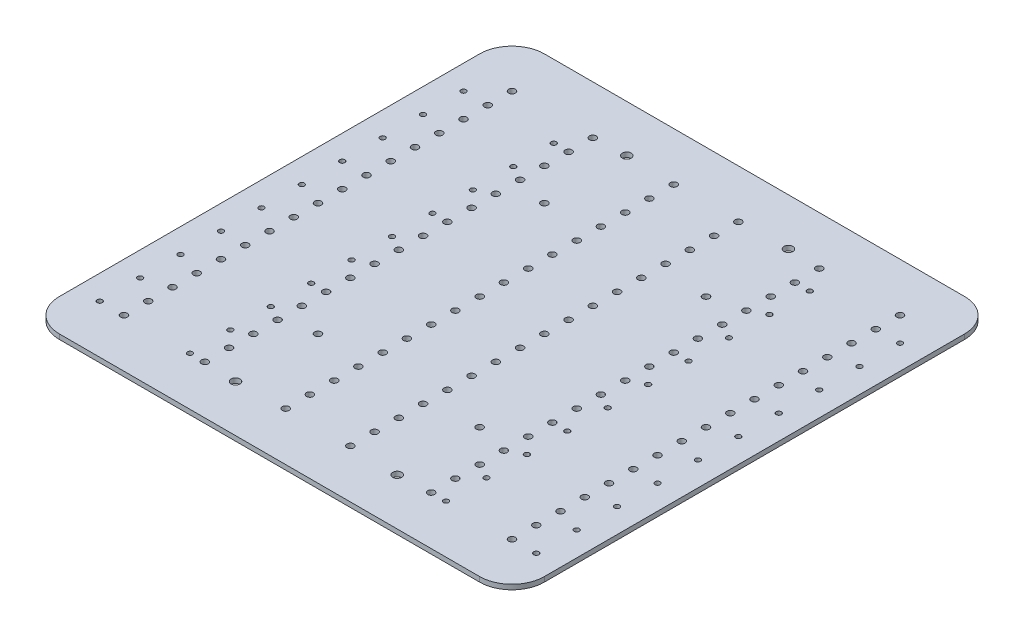
from build123d import *

# Parameters (mm, degrees)
SKETCH_2_W                        = 300
SKETCH_2_H                        = 300
EXTRUDE_1_DEPTH                   = 3
FILLET_1_R                        = 20
SKETCH_3_R                        = 2.1
CUT_EXTRUDE_1_DEPTH               = 213.153246499
MIRROR_2_COPY_1_SKETCH_R          = 2.1
MIRROR_2_COPY_1_DEPTH             = 213.153246499
SKETCH_4_R                        = 2.75
CUT_EXTRUDE_2_DEPTH               = 213.153246499
MIRROR_4_COPY_1_SKETCH_R          = 2.75
MIRROR_4_COPY_1_DEPTH             = 213.153246499
SKETCH_5_R                        = 2.1
CUT_EXTRUDE_3_DEPTH               = 213.153246499
PATTERN_LINEAR_1_COUNT            = 17
PATTERN_LINEAR_1_PITCH            = 15
PATTERN_LINEAR_2_COUNT            = 3
PATTERN_LINEAR_2_PITCH            = 50
PATTERN_LINEAR_2_COPY_1_SKETCH_R  = 2.1
PATTERN_LINEAR_2_COPY_1_DEPTH     = 213.153246499
PATTERN_LINEAR_2_COPY_2_SKETCH_R  = 2.1
PATTERN_LINEAR_2_COPY_2_DEPTH     = 213.153246499
PATTERN_LINEAR_2_COPY_3_SKETCH_R  = 2.1
PATTERN_LINEAR_2_COPY_3_DEPTH     = 213.153246499
PATTERN_LINEAR_2_COPY_4_SKETCH_R  = 2.1
PATTERN_LINEAR_2_COPY_4_DEPTH     = 213.153246499
PATTERN_LINEAR_2_COPY_5_SKETCH_R  = 2.1
PATTERN_LINEAR_2_COPY_5_DEPTH     = 213.153246499
PATTERN_LINEAR_2_COPY_6_SKETCH_R  = 2.1
PATTERN_LINEAR_2_COPY_6_DEPTH     = 213.153246499
PATTERN_LINEAR_2_COPY_7_SKETCH_R  = 2.1
PATTERN_LINEAR_2_COPY_7_DEPTH     = 213.153246499
PATTERN_LINEAR_2_COPY_8_SKETCH_R  = 2.1
PATTERN_LINEAR_2_COPY_8_DEPTH     = 213.153246499
PATTERN_LINEAR_2_COPY_9_SKETCH_R  = 2.1
PATTERN_LINEAR_2_COPY_9_DEPTH     = 213.153246499
PATTERN_LINEAR_2_COPY_10_SKETCH_R = 2.1
PATTERN_LINEAR_2_COPY_10_DEPTH    = 213.153246499
PATTERN_LINEAR_2_COPY_11_SKETCH_R = 2.1
PATTERN_LINEAR_2_COPY_11_DEPTH    = 213.153246499
PATTERN_LINEAR_2_COPY_12_SKETCH_R = 2.1
PATTERN_LINEAR_2_COPY_12_DEPTH    = 213.153246499
PATTERN_LINEAR_2_COPY_13_SKETCH_R = 2.1
PATTERN_LINEAR_2_COPY_13_DEPTH    = 213.153246499
PATTERN_LINEAR_2_COPY_14_SKETCH_R = 2.1
PATTERN_LINEAR_2_COPY_14_DEPTH    = 213.153246499
PATTERN_LINEAR_2_COPY_15_SKETCH_R = 2.1
PATTERN_LINEAR_2_COPY_15_DEPTH    = 213.153246499
PATTERN_LINEAR_2_COPY_16_SKETCH_R = 2.1
PATTERN_LINEAR_2_COPY_16_DEPTH    = 213.153246499
PATTERN_LINEAR_2_COPY_17_SKETCH_R = 2.1
PATTERN_LINEAR_2_COPY_17_DEPTH    = 213.153246499
PATTERN_LINEAR_2_COPY_18_SKETCH_R = 2.1
PATTERN_LINEAR_2_COPY_18_DEPTH    = 213.153246499
PATTERN_LINEAR_2_COPY_19_SKETCH_R = 2.1
PATTERN_LINEAR_2_COPY_19_DEPTH    = 213.153246499
PATTERN_LINEAR_2_COPY_20_SKETCH_R = 2.1
PATTERN_LINEAR_2_COPY_20_DEPTH    = 213.153246499
PATTERN_LINEAR_2_COPY_21_SKETCH_R = 2.1
PATTERN_LINEAR_2_COPY_21_DEPTH    = 213.153246499
PATTERN_LINEAR_2_COPY_22_SKETCH_R = 2.1
PATTERN_LINEAR_2_COPY_22_DEPTH    = 213.153246499
PATTERN_LINEAR_2_COPY_23_SKETCH_R = 2.1
PATTERN_LINEAR_2_COPY_23_DEPTH    = 213.153246499
PATTERN_LINEAR_2_COPY_24_SKETCH_R = 2.1
PATTERN_LINEAR_2_COPY_24_DEPTH    = 213.153246499
PATTERN_LINEAR_2_COPY_25_SKETCH_R = 2.1
PATTERN_LINEAR_2_COPY_25_DEPTH    = 213.153246499
PATTERN_LINEAR_2_COPY_26_SKETCH_R = 2.1
PATTERN_LINEAR_2_COPY_26_DEPTH    = 213.153246499
PATTERN_LINEAR_2_COPY_27_SKETCH_R = 2.1
PATTERN_LINEAR_2_COPY_27_DEPTH    = 213.153246499
PATTERN_LINEAR_2_COPY_28_SKETCH_R = 2.1
PATTERN_LINEAR_2_COPY_28_DEPTH    = 213.153246499
PATTERN_LINEAR_2_COPY_29_SKETCH_R = 2.1
PATTERN_LINEAR_2_COPY_29_DEPTH    = 213.153246499
PATTERN_LINEAR_2_COPY_30_SKETCH_R = 2.1
PATTERN_LINEAR_2_COPY_30_DEPTH    = 213.153246499
PATTERN_LINEAR_2_COPY_31_SKETCH_R = 2.1
PATTERN_LINEAR_2_COPY_31_DEPTH    = 213.153246499
PATTERN_LINEAR_2_COPY_32_SKETCH_R = 2.1
PATTERN_LINEAR_2_COPY_32_DEPTH    = 213.153246499
MIRROR_5_COPY_1_SKETCH_R          = 2.1
MIRROR_5_COPY_1_DEPTH             = 213.153246499
MIRROR_5_COPY_2_SKETCH_R          = 2.1
MIRROR_5_COPY_2_DEPTH             = 213.153246499
MIRROR_5_COPY_3_SKETCH_R          = 2.1
MIRROR_5_COPY_3_DEPTH             = 213.153246499
MIRROR_5_COPY_4_SKETCH_R          = 2.1
MIRROR_5_COPY_4_DEPTH             = 213.153246499
MIRROR_5_COPY_5_SKETCH_R          = 2.1
MIRROR_5_COPY_5_DEPTH             = 213.153246499
MIRROR_5_COPY_6_SKETCH_R          = 2.1
MIRROR_5_COPY_6_DEPTH             = 213.153246499
MIRROR_5_COPY_7_SKETCH_R          = 2.1
MIRROR_5_COPY_7_DEPTH             = 213.153246499
MIRROR_5_COPY_8_SKETCH_R          = 2.1
MIRROR_5_COPY_8_DEPTH             = 213.153246499
MIRROR_5_COPY_9_SKETCH_R          = 2.1
MIRROR_5_COPY_9_DEPTH             = 213.153246499
MIRROR_5_COPY_10_SKETCH_R         = 2.1
MIRROR_5_COPY_10_DEPTH            = 213.153246499
MIRROR_5_COPY_11_SKETCH_R         = 2.1
MIRROR_5_COPY_11_DEPTH            = 213.153246499
MIRROR_5_COPY_12_SKETCH_R         = 2.1
MIRROR_5_COPY_12_DEPTH            = 213.153246499
MIRROR_5_COPY_13_SKETCH_R         = 2.1
MIRROR_5_COPY_13_DEPTH            = 213.153246499
MIRROR_5_COPY_14_SKETCH_R         = 2.1
MIRROR_5_COPY_14_DEPTH            = 213.153246499
MIRROR_5_COPY_15_SKETCH_R         = 2.1
MIRROR_5_COPY_15_DEPTH            = 213.153246499
MIRROR_5_COPY_16_SKETCH_R         = 2.1
MIRROR_5_COPY_16_DEPTH            = 213.153246499
MIRROR_5_COPY_17_SKETCH_R         = 2.1
MIRROR_5_COPY_17_DEPTH            = 213.153246499
MIRROR_5_COPY_18_SKETCH_R         = 2.1
MIRROR_5_COPY_18_DEPTH            = 213.153246499
MIRROR_5_COPY_19_SKETCH_R         = 2.1
MIRROR_5_COPY_19_DEPTH            = 213.153246499
MIRROR_5_COPY_20_SKETCH_R         = 2.1
MIRROR_5_COPY_20_DEPTH            = 213.153246499
MIRROR_5_COPY_21_SKETCH_R         = 2.1
MIRROR_5_COPY_21_DEPTH            = 213.153246499
MIRROR_5_COPY_22_SKETCH_R         = 2.1
MIRROR_5_COPY_22_DEPTH            = 213.153246499
MIRROR_5_COPY_23_SKETCH_R         = 2.1
MIRROR_5_COPY_23_DEPTH            = 213.153246499
MIRROR_5_COPY_24_SKETCH_R         = 2.1
MIRROR_5_COPY_24_DEPTH            = 213.153246499
MIRROR_5_COPY_25_SKETCH_R         = 2.1
MIRROR_5_COPY_25_DEPTH            = 213.153246499
MIRROR_5_COPY_26_SKETCH_R         = 2.1
MIRROR_5_COPY_26_DEPTH            = 213.153246499
MIRROR_5_COPY_27_SKETCH_R         = 2.1
MIRROR_5_COPY_27_DEPTH            = 213.153246499
MIRROR_5_COPY_28_SKETCH_R         = 2.1
MIRROR_5_COPY_28_DEPTH            = 213.153246499
MIRROR_5_COPY_29_SKETCH_R         = 2.1
MIRROR_5_COPY_29_DEPTH            = 213.153246499
MIRROR_5_COPY_30_SKETCH_R         = 2.1
MIRROR_5_COPY_30_DEPTH            = 213.153246499
MIRROR_5_COPY_31_SKETCH_R         = 2.1
MIRROR_5_COPY_31_DEPTH            = 213.153246499
MIRROR_5_COPY_32_SKETCH_R         = 2.1
MIRROR_5_COPY_32_DEPTH            = 213.153246499
MIRROR_5_COPY_33_SKETCH_R         = 2.1
MIRROR_5_COPY_33_DEPTH            = 213.153246499
MIRROR_5_COPY_34_SKETCH_R         = 2.1
MIRROR_5_COPY_34_DEPTH            = 213.153246499
MIRROR_5_COPY_35_SKETCH_R         = 2.1
MIRROR_5_COPY_35_DEPTH            = 213.153246499
MIRROR_5_COPY_36_SKETCH_R         = 2.1
MIRROR_5_COPY_36_DEPTH            = 213.153246499
MIRROR_5_COPY_37_SKETCH_R         = 2.1
MIRROR_5_COPY_37_DEPTH            = 213.153246499
MIRROR_5_COPY_38_SKETCH_R         = 2.1
MIRROR_5_COPY_38_DEPTH            = 213.153246499
MIRROR_5_COPY_39_SKETCH_R         = 2.1
MIRROR_5_COPY_39_DEPTH            = 213.153246499
MIRROR_5_COPY_40_SKETCH_R         = 2.1
MIRROR_5_COPY_40_DEPTH            = 213.153246499
MIRROR_5_COPY_41_SKETCH_R         = 2.1
MIRROR_5_COPY_41_DEPTH            = 213.153246499
MIRROR_5_COPY_42_SKETCH_R         = 2.1
MIRROR_5_COPY_42_DEPTH            = 213.153246499
MIRROR_5_COPY_43_SKETCH_R         = 2.1
MIRROR_5_COPY_43_DEPTH            = 213.153246499
MIRROR_5_COPY_44_SKETCH_R         = 2.1
MIRROR_5_COPY_44_DEPTH            = 213.153246499
MIRROR_5_COPY_45_SKETCH_R         = 2.1
MIRROR_5_COPY_45_DEPTH            = 213.153246499
MIRROR_5_COPY_46_SKETCH_R         = 2.1
MIRROR_5_COPY_46_DEPTH            = 213.153246499
MIRROR_5_COPY_47_SKETCH_R         = 2.1
MIRROR_5_COPY_47_DEPTH            = 213.153246499
MIRROR_5_COPY_48_SKETCH_R         = 2.1
MIRROR_5_COPY_48_DEPTH            = 213.153246499
MIRROR_5_COPY_49_SKETCH_R         = 2.1
MIRROR_5_COPY_49_DEPTH            = 213.153246499
MIRROR_5_COPY_50_SKETCH_R         = 2.1
MIRROR_5_COPY_50_DEPTH            = 213.153246499
SKETCH_6_R                        = 1.6
CUT_EXTRUDE_4_DEPTH               = 213.153246499
PATTERN_LINEAR_3_COUNT            = 10
PATTERN_LINEAR_3_PITCH            = 25
PATTERN_LINEAR_4_COUNT            = 2
PATTERN_LINEAR_4_PITCH            = 55.8
PATTERN_LINEAR_4_COPY_1_SKETCH_R  = 1.6
PATTERN_LINEAR_4_COPY_1_DEPTH     = 213.153246499
PATTERN_LINEAR_4_COPY_2_SKETCH_R  = 1.6
PATTERN_LINEAR_4_COPY_2_DEPTH     = 213.153246499
PATTERN_LINEAR_4_COPY_3_SKETCH_R  = 1.6
PATTERN_LINEAR_4_COPY_3_DEPTH     = 213.153246499
PATTERN_LINEAR_4_COPY_4_SKETCH_R  = 1.6
PATTERN_LINEAR_4_COPY_4_DEPTH     = 213.153246499
PATTERN_LINEAR_4_COPY_5_SKETCH_R  = 1.6
PATTERN_LINEAR_4_COPY_5_DEPTH     = 213.153246499
PATTERN_LINEAR_4_COPY_6_SKETCH_R  = 1.6
PATTERN_LINEAR_4_COPY_6_DEPTH     = 213.153246499
PATTERN_LINEAR_4_COPY_7_SKETCH_R  = 1.6
PATTERN_LINEAR_4_COPY_7_DEPTH     = 213.153246499
PATTERN_LINEAR_4_COPY_8_SKETCH_R  = 1.6
PATTERN_LINEAR_4_COPY_8_DEPTH     = 213.153246499
PATTERN_LINEAR_4_COPY_9_SKETCH_R  = 1.6
PATTERN_LINEAR_4_COPY_9_DEPTH     = 213.153246499
MIRROR_6_COPY_1_SKETCH_R          = 1.6
MIRROR_6_COPY_1_DEPTH             = 213.153246499
MIRROR_6_COPY_2_SKETCH_R          = 1.6
MIRROR_6_COPY_2_DEPTH             = 213.153246499
MIRROR_6_COPY_3_SKETCH_R          = 1.6
MIRROR_6_COPY_3_DEPTH             = 213.153246499
MIRROR_6_COPY_4_SKETCH_R          = 1.6
MIRROR_6_COPY_4_DEPTH             = 213.153246499
MIRROR_6_COPY_5_SKETCH_R          = 1.6
MIRROR_6_COPY_5_DEPTH             = 213.153246499
MIRROR_6_COPY_6_SKETCH_R          = 1.6
MIRROR_6_COPY_6_DEPTH             = 213.153246499
MIRROR_6_COPY_7_SKETCH_R          = 1.6
MIRROR_6_COPY_7_DEPTH             = 213.153246499
MIRROR_6_COPY_8_SKETCH_R          = 1.6
MIRROR_6_COPY_8_DEPTH             = 213.153246499
MIRROR_6_COPY_9_SKETCH_R          = 1.6
MIRROR_6_COPY_9_DEPTH             = 213.153246499
MIRROR_6_COPY_10_SKETCH_R         = 1.6
MIRROR_6_COPY_10_DEPTH            = 213.153246499
MIRROR_6_COPY_11_SKETCH_R         = 1.6
MIRROR_6_COPY_11_DEPTH            = 213.153246499
MIRROR_6_COPY_12_SKETCH_R         = 1.6
MIRROR_6_COPY_12_DEPTH            = 213.153246499
MIRROR_6_COPY_13_SKETCH_R         = 1.6
MIRROR_6_COPY_13_DEPTH            = 213.153246499
MIRROR_6_COPY_14_SKETCH_R         = 1.6
MIRROR_6_COPY_14_DEPTH            = 213.153246499
MIRROR_6_COPY_15_SKETCH_R         = 1.6
MIRROR_6_COPY_15_DEPTH            = 213.153246499
MIRROR_6_COPY_16_SKETCH_R         = 1.6
MIRROR_6_COPY_16_DEPTH            = 213.153246499
MIRROR_6_COPY_17_SKETCH_R         = 1.6
MIRROR_6_COPY_17_DEPTH            = 213.153246499
MIRROR_6_COPY_18_SKETCH_R         = 1.6
MIRROR_6_COPY_18_DEPTH            = 213.153246499
MIRROR_6_COPY_19_SKETCH_R         = 1.6
MIRROR_6_COPY_19_DEPTH            = 213.153246499


with BuildPart() as part:
    # 草图2 → 凸台-拉伸1 (new body)
    with BuildSketch(Plane(origin=(0, 0, 0), x_dir=(1, 0, 0), z_dir=(0, 1, 0))):
        Rectangle(SKETCH_2_W, SKETCH_2_H)
    extrude(amount=EXTRUDE_1_DEPTH)

    # 圆角1
    fillet_1_edges = [part.edges().sort_by_distance(p)[0] for p in [
        (150, 1.5, 150),
        (-150, 1.5, 150),
        (-150, 1.5, -150),
        (150, 1.5, -150),
    ]]
    fillet(fillet_1_edges, radius=FILLET_1_R)

    # 草图3 → 切除-拉伸1 (cut, through all)
    with BuildSketch(Plane.XZ):
        with Locations(Location((-50, 70, 0), (0, 0, 270))):
            Circle(SKETCH_3_R)
    cut_extrude_1 = extrude(amount=-CUT_EXTRUDE_1_DEPTH, mode=Mode.SUBTRACT)

    # 镜向1: 切除-拉伸1 across plane
    add(cut_extrude_1.mirror(Plane.ZY), mode=Mode.SUBTRACT)

    # 镜向2: 切除-拉伸1 across plane
    add(cut_extrude_1.mirror(Plane(origin=(0, 0, 0), x_dir=(1, 0, 0), z_dir=(0, 0, -1))), mode=Mode.SUBTRACT)

    # 镜向2 copy 1 sketch → 镜向2 copy 1 (cut, through all)
    with BuildSketch(Plane(origin=(0, 0, 0), x_dir=(-1, 0, 0), z_dir=(0, -1, 0))):
        with Locations(Location((-50, 70, 0), (0, 0, 270))):
            Circle(MIRROR_2_COPY_1_SKETCH_R)
    extrude(amount=-MIRROR_2_COPY_1_DEPTH, mode=Mode.SUBTRACT)

    # 草图4 → 切除-拉伸2 (cut, through all)
    with BuildSketch(Plane(origin=(0, 3, 0), x_dir=(1, 0, 0), z_dir=(0, 1, 0))):
        with Locations(Location((-50, -121, 0), (0, 0, 270))):
            Circle(SKETCH_4_R)
    cut_extrude_2 = extrude(amount=-CUT_EXTRUDE_2_DEPTH, mode=Mode.SUBTRACT)

    # 镜向3: 切除-拉伸2 across plane
    add(cut_extrude_2.mirror(Plane.ZY), mode=Mode.SUBTRACT)

    # 镜向4: 切除-拉伸2 across plane
    add(cut_extrude_2.mirror(Plane(origin=(0, 0, 0), x_dir=(1, 0, 0), z_dir=(0, 0, -1))), mode=Mode.SUBTRACT)

    # 镜向4 copy 1 sketch → 镜向4 copy 1 (cut, through all)
    with BuildSketch(Plane(origin=(0, 3, 0), x_dir=(-1, 0, 0), z_dir=(0, 1, 0))):
        with Locations(Location((-50, -121, 0), (0, 0, 270))):
            Circle(MIRROR_4_COPY_1_SKETCH_R)
    extrude(amount=-MIRROR_4_COPY_1_DEPTH, mode=Mode.SUBTRACT)

    # 草图5 → 切除-拉伸3 (cut, through all)
    with BuildSketch(Plane(origin=(0, 3, 0), x_dir=(1, 0, 0), z_dir=(0, 1, 0))):
        with Locations(Location((-120, -120, 0), (0, 0, 270))):
            Circle(SKETCH_5_R)
    cut_extrude_3 = extrude(amount=-CUT_EXTRUDE_3_DEPTH, mode=Mode.SUBTRACT)

    # 阵列(线性)1: 切除-拉伸3 ×17
    with Locations(*[(0, 0, -i * PATTERN_LINEAR_1_PITCH) for i in range(1, PATTERN_LINEAR_1_COUNT)]):
        add(cut_extrude_3, mode=Mode.SUBTRACT)

    # 阵列(线性)2: 切除-拉伸3 ×3
    with Locations(*[(i * PATTERN_LINEAR_2_PITCH, 0, 0) for i in range(1, PATTERN_LINEAR_2_COUNT)]):
        add(cut_extrude_3, mode=Mode.SUBTRACT)

    # 阵列(线性)2 copy 1 sketch → 阵列(线性)2 copy 1 (cut, through all)
    with BuildSketch(Plane(origin=(50, 3, -15), x_dir=(1, 0, 0), z_dir=(0, 1, 0))):
        with Locations(Location((-120, -120, 0), (0, 0, 270))):
            Circle(PATTERN_LINEAR_2_COPY_1_SKETCH_R)
    extrude(amount=-PATTERN_LINEAR_2_COPY_1_DEPTH, mode=Mode.SUBTRACT)

    # 阵列(线性)2 copy 2 sketch → 阵列(线性)2 copy 2 (cut, through all)
    with BuildSketch(Plane(origin=(100, 3, -15), x_dir=(1, 0, 0), z_dir=(0, 1, 0))):
        with Locations(Location((-120, -120, 0), (0, 0, 270))):
            Circle(PATTERN_LINEAR_2_COPY_2_SKETCH_R)
    extrude(amount=-PATTERN_LINEAR_2_COPY_2_DEPTH, mode=Mode.SUBTRACT)

    # 阵列(线性)2 copy 3 sketch → 阵列(线性)2 copy 3 (cut, through all)
    with BuildSketch(Plane(origin=(50, 3, -30), x_dir=(1, 0, 0), z_dir=(0, 1, 0))):
        with Locations(Location((-120, -120, 0), (0, 0, 270))):
            Circle(PATTERN_LINEAR_2_COPY_3_SKETCH_R)
    extrude(amount=-PATTERN_LINEAR_2_COPY_3_DEPTH, mode=Mode.SUBTRACT)

    # 阵列(线性)2 copy 4 sketch → 阵列(线性)2 copy 4 (cut, through all)
    with BuildSketch(Plane(origin=(100, 3, -30), x_dir=(1, 0, 0), z_dir=(0, 1, 0))):
        with Locations(Location((-120, -120, 0), (0, 0, 270))):
            Circle(PATTERN_LINEAR_2_COPY_4_SKETCH_R)
    extrude(amount=-PATTERN_LINEAR_2_COPY_4_DEPTH, mode=Mode.SUBTRACT)

    # 阵列(线性)2 copy 5 sketch → 阵列(线性)2 copy 5 (cut, through all)
    with BuildSketch(Plane(origin=(50, 3, -45), x_dir=(1, 0, 0), z_dir=(0, 1, 0))):
        with Locations(Location((-120, -120, 0), (0, 0, 270))):
            Circle(PATTERN_LINEAR_2_COPY_5_SKETCH_R)
    extrude(amount=-PATTERN_LINEAR_2_COPY_5_DEPTH, mode=Mode.SUBTRACT)

    # 阵列(线性)2 copy 6 sketch → 阵列(线性)2 copy 6 (cut, through all)
    with BuildSketch(Plane(origin=(100, 3, -45), x_dir=(1, 0, 0), z_dir=(0, 1, 0))):
        with Locations(Location((-120, -120, 0), (0, 0, 270))):
            Circle(PATTERN_LINEAR_2_COPY_6_SKETCH_R)
    extrude(amount=-PATTERN_LINEAR_2_COPY_6_DEPTH, mode=Mode.SUBTRACT)

    # 阵列(线性)2 copy 7 sketch → 阵列(线性)2 copy 7 (cut, through all)
    with BuildSketch(Plane(origin=(50, 3, -60), x_dir=(1, 0, 0), z_dir=(0, 1, 0))):
        with Locations(Location((-120, -120, 0), (0, 0, 270))):
            Circle(PATTERN_LINEAR_2_COPY_7_SKETCH_R)
    extrude(amount=-PATTERN_LINEAR_2_COPY_7_DEPTH, mode=Mode.SUBTRACT)

    # 阵列(线性)2 copy 8 sketch → 阵列(线性)2 copy 8 (cut, through all)
    with BuildSketch(Plane(origin=(100, 3, -60), x_dir=(1, 0, 0), z_dir=(0, 1, 0))):
        with Locations(Location((-120, -120, 0), (0, 0, 270))):
            Circle(PATTERN_LINEAR_2_COPY_8_SKETCH_R)
    extrude(amount=-PATTERN_LINEAR_2_COPY_8_DEPTH, mode=Mode.SUBTRACT)

    # 阵列(线性)2 copy 9 sketch → 阵列(线性)2 copy 9 (cut, through all)
    with BuildSketch(Plane(origin=(50, 3, -75), x_dir=(1, 0, 0), z_dir=(0, 1, 0))):
        with Locations(Location((-120, -120, 0), (0, 0, 270))):
            Circle(PATTERN_LINEAR_2_COPY_9_SKETCH_R)
    extrude(amount=-PATTERN_LINEAR_2_COPY_9_DEPTH, mode=Mode.SUBTRACT)

    # 阵列(线性)2 copy 10 sketch → 阵列(线性)2 copy 10 (cut, through all)
    with BuildSketch(Plane(origin=(100, 3, -75), x_dir=(1, 0, 0), z_dir=(0, 1, 0))):
        with Locations(Location((-120, -120, 0), (0, 0, 270))):
            Circle(PATTERN_LINEAR_2_COPY_10_SKETCH_R)
    extrude(amount=-PATTERN_LINEAR_2_COPY_10_DEPTH, mode=Mode.SUBTRACT)

    # 阵列(线性)2 copy 11 sketch → 阵列(线性)2 copy 11 (cut, through all)
    with BuildSketch(Plane(origin=(50, 3, -90), x_dir=(1, 0, 0), z_dir=(0, 1, 0))):
        with Locations(Location((-120, -120, 0), (0, 0, 270))):
            Circle(PATTERN_LINEAR_2_COPY_11_SKETCH_R)
    extrude(amount=-PATTERN_LINEAR_2_COPY_11_DEPTH, mode=Mode.SUBTRACT)

    # 阵列(线性)2 copy 12 sketch → 阵列(线性)2 copy 12 (cut, through all)
    with BuildSketch(Plane(origin=(100, 3, -90), x_dir=(1, 0, 0), z_dir=(0, 1, 0))):
        with Locations(Location((-120, -120, 0), (0, 0, 270))):
            Circle(PATTERN_LINEAR_2_COPY_12_SKETCH_R)
    extrude(amount=-PATTERN_LINEAR_2_COPY_12_DEPTH, mode=Mode.SUBTRACT)

    # 阵列(线性)2 copy 13 sketch → 阵列(线性)2 copy 13 (cut, through all)
    with BuildSketch(Plane(origin=(50, 3, -105), x_dir=(1, 0, 0), z_dir=(0, 1, 0))):
        with Locations(Location((-120, -120, 0), (0, 0, 270))):
            Circle(PATTERN_LINEAR_2_COPY_13_SKETCH_R)
    extrude(amount=-PATTERN_LINEAR_2_COPY_13_DEPTH, mode=Mode.SUBTRACT)

    # 阵列(线性)2 copy 14 sketch → 阵列(线性)2 copy 14 (cut, through all)
    with BuildSketch(Plane(origin=(100, 3, -105), x_dir=(1, 0, 0), z_dir=(0, 1, 0))):
        with Locations(Location((-120, -120, 0), (0, 0, 270))):
            Circle(PATTERN_LINEAR_2_COPY_14_SKETCH_R)
    extrude(amount=-PATTERN_LINEAR_2_COPY_14_DEPTH, mode=Mode.SUBTRACT)

    # 阵列(线性)2 copy 15 sketch → 阵列(线性)2 copy 15 (cut, through all)
    with BuildSketch(Plane(origin=(50, 3, -120), x_dir=(1, 0, 0), z_dir=(0, 1, 0))):
        with Locations(Location((-120, -120, 0), (0, 0, 270))):
            Circle(PATTERN_LINEAR_2_COPY_15_SKETCH_R)
    extrude(amount=-PATTERN_LINEAR_2_COPY_15_DEPTH, mode=Mode.SUBTRACT)

    # 阵列(线性)2 copy 16 sketch → 阵列(线性)2 copy 16 (cut, through all)
    with BuildSketch(Plane(origin=(100, 3, -120), x_dir=(1, 0, 0), z_dir=(0, 1, 0))):
        with Locations(Location((-120, -120, 0), (0, 0, 270))):
            Circle(PATTERN_LINEAR_2_COPY_16_SKETCH_R)
    extrude(amount=-PATTERN_LINEAR_2_COPY_16_DEPTH, mode=Mode.SUBTRACT)

    # 阵列(线性)2 copy 17 sketch → 阵列(线性)2 copy 17 (cut, through all)
    with BuildSketch(Plane(origin=(50, 3, -135), x_dir=(1, 0, 0), z_dir=(0, 1, 0))):
        with Locations(Location((-120, -120, 0), (0, 0, 270))):
            Circle(PATTERN_LINEAR_2_COPY_17_SKETCH_R)
    extrude(amount=-PATTERN_LINEAR_2_COPY_17_DEPTH, mode=Mode.SUBTRACT)

    # 阵列(线性)2 copy 18 sketch → 阵列(线性)2 copy 18 (cut, through all)
    with BuildSketch(Plane(origin=(100, 3, -135), x_dir=(1, 0, 0), z_dir=(0, 1, 0))):
        with Locations(Location((-120, -120, 0), (0, 0, 270))):
            Circle(PATTERN_LINEAR_2_COPY_18_SKETCH_R)
    extrude(amount=-PATTERN_LINEAR_2_COPY_18_DEPTH, mode=Mode.SUBTRACT)

    # 阵列(线性)2 copy 19 sketch → 阵列(线性)2 copy 19 (cut, through all)
    with BuildSketch(Plane(origin=(50, 3, -150), x_dir=(1, 0, 0), z_dir=(0, 1, 0))):
        with Locations(Location((-120, -120, 0), (0, 0, 270))):
            Circle(PATTERN_LINEAR_2_COPY_19_SKETCH_R)
    extrude(amount=-PATTERN_LINEAR_2_COPY_19_DEPTH, mode=Mode.SUBTRACT)

    # 阵列(线性)2 copy 20 sketch → 阵列(线性)2 copy 20 (cut, through all)
    with BuildSketch(Plane(origin=(100, 3, -150), x_dir=(1, 0, 0), z_dir=(0, 1, 0))):
        with Locations(Location((-120, -120, 0), (0, 0, 270))):
            Circle(PATTERN_LINEAR_2_COPY_20_SKETCH_R)
    extrude(amount=-PATTERN_LINEAR_2_COPY_20_DEPTH, mode=Mode.SUBTRACT)

    # 阵列(线性)2 copy 21 sketch → 阵列(线性)2 copy 21 (cut, through all)
    with BuildSketch(Plane(origin=(50, 3, -165), x_dir=(1, 0, 0), z_dir=(0, 1, 0))):
        with Locations(Location((-120, -120, 0), (0, 0, 270))):
            Circle(PATTERN_LINEAR_2_COPY_21_SKETCH_R)
    extrude(amount=-PATTERN_LINEAR_2_COPY_21_DEPTH, mode=Mode.SUBTRACT)

    # 阵列(线性)2 copy 22 sketch → 阵列(线性)2 copy 22 (cut, through all)
    with BuildSketch(Plane(origin=(100, 3, -165), x_dir=(1, 0, 0), z_dir=(0, 1, 0))):
        with Locations(Location((-120, -120, 0), (0, 0, 270))):
            Circle(PATTERN_LINEAR_2_COPY_22_SKETCH_R)
    extrude(amount=-PATTERN_LINEAR_2_COPY_22_DEPTH, mode=Mode.SUBTRACT)

    # 阵列(线性)2 copy 23 sketch → 阵列(线性)2 copy 23 (cut, through all)
    with BuildSketch(Plane(origin=(50, 3, -180), x_dir=(1, 0, 0), z_dir=(0, 1, 0))):
        with Locations(Location((-120, -120, 0), (0, 0, 270))):
            Circle(PATTERN_LINEAR_2_COPY_23_SKETCH_R)
    extrude(amount=-PATTERN_LINEAR_2_COPY_23_DEPTH, mode=Mode.SUBTRACT)

    # 阵列(线性)2 copy 24 sketch → 阵列(线性)2 copy 24 (cut, through all)
    with BuildSketch(Plane(origin=(100, 3, -180), x_dir=(1, 0, 0), z_dir=(0, 1, 0))):
        with Locations(Location((-120, -120, 0), (0, 0, 270))):
            Circle(PATTERN_LINEAR_2_COPY_24_SKETCH_R)
    extrude(amount=-PATTERN_LINEAR_2_COPY_24_DEPTH, mode=Mode.SUBTRACT)

    # 阵列(线性)2 copy 25 sketch → 阵列(线性)2 copy 25 (cut, through all)
    with BuildSketch(Plane(origin=(50, 3, -195), x_dir=(1, 0, 0), z_dir=(0, 1, 0))):
        with Locations(Location((-120, -120, 0), (0, 0, 270))):
            Circle(PATTERN_LINEAR_2_COPY_25_SKETCH_R)
    extrude(amount=-PATTERN_LINEAR_2_COPY_25_DEPTH, mode=Mode.SUBTRACT)

    # 阵列(线性)2 copy 26 sketch → 阵列(线性)2 copy 26 (cut, through all)
    with BuildSketch(Plane(origin=(100, 3, -195), x_dir=(1, 0, 0), z_dir=(0, 1, 0))):
        with Locations(Location((-120, -120, 0), (0, 0, 270))):
            Circle(PATTERN_LINEAR_2_COPY_26_SKETCH_R)
    extrude(amount=-PATTERN_LINEAR_2_COPY_26_DEPTH, mode=Mode.SUBTRACT)

    # 阵列(线性)2 copy 27 sketch → 阵列(线性)2 copy 27 (cut, through all)
    with BuildSketch(Plane(origin=(50, 3, -210), x_dir=(1, 0, 0), z_dir=(0, 1, 0))):
        with Locations(Location((-120, -120, 0), (0, 0, 270))):
            Circle(PATTERN_LINEAR_2_COPY_27_SKETCH_R)
    extrude(amount=-PATTERN_LINEAR_2_COPY_27_DEPTH, mode=Mode.SUBTRACT)

    # 阵列(线性)2 copy 28 sketch → 阵列(线性)2 copy 28 (cut, through all)
    with BuildSketch(Plane(origin=(100, 3, -210), x_dir=(1, 0, 0), z_dir=(0, 1, 0))):
        with Locations(Location((-120, -120, 0), (0, 0, 270))):
            Circle(PATTERN_LINEAR_2_COPY_28_SKETCH_R)
    extrude(amount=-PATTERN_LINEAR_2_COPY_28_DEPTH, mode=Mode.SUBTRACT)

    # 阵列(线性)2 copy 29 sketch → 阵列(线性)2 copy 29 (cut, through all)
    with BuildSketch(Plane(origin=(50, 3, -225), x_dir=(1, 0, 0), z_dir=(0, 1, 0))):
        with Locations(Location((-120, -120, 0), (0, 0, 270))):
            Circle(PATTERN_LINEAR_2_COPY_29_SKETCH_R)
    extrude(amount=-PATTERN_LINEAR_2_COPY_29_DEPTH, mode=Mode.SUBTRACT)

    # 阵列(线性)2 copy 30 sketch → 阵列(线性)2 copy 30 (cut, through all)
    with BuildSketch(Plane(origin=(100, 3, -225), x_dir=(1, 0, 0), z_dir=(0, 1, 0))):
        with Locations(Location((-120, -120, 0), (0, 0, 270))):
            Circle(PATTERN_LINEAR_2_COPY_30_SKETCH_R)
    extrude(amount=-PATTERN_LINEAR_2_COPY_30_DEPTH, mode=Mode.SUBTRACT)

    # 阵列(线性)2 copy 31 sketch → 阵列(线性)2 copy 31 (cut, through all)
    with BuildSketch(Plane(origin=(50, 3, -240), x_dir=(1, 0, 0), z_dir=(0, 1, 0))):
        with Locations(Location((-120, -120, 0), (0, 0, 270))):
            Circle(PATTERN_LINEAR_2_COPY_31_SKETCH_R)
    extrude(amount=-PATTERN_LINEAR_2_COPY_31_DEPTH, mode=Mode.SUBTRACT)

    # 阵列(线性)2 copy 32 sketch → 阵列(线性)2 copy 32 (cut, through all)
    with BuildSketch(Plane(origin=(100, 3, -240), x_dir=(1, 0, 0), z_dir=(0, 1, 0))):
        with Locations(Location((-120, -120, 0), (0, 0, 270))):
            Circle(PATTERN_LINEAR_2_COPY_32_SKETCH_R)
    extrude(amount=-PATTERN_LINEAR_2_COPY_32_DEPTH, mode=Mode.SUBTRACT)

    # 镜向5: 切除-拉伸3 across plane
    add(cut_extrude_3.mirror(Plane.ZY), mode=Mode.SUBTRACT)

    # 镜向5 copy 1 sketch → 镜向5 copy 1 (cut, through all)
    with BuildSketch(Plane(origin=(0, 3, -15), x_dir=(-1, 0, 0), z_dir=(0, 1, 0))):
        with Locations((-120, 120)):
            Circle(MIRROR_5_COPY_1_SKETCH_R)
    extrude(amount=-MIRROR_5_COPY_1_DEPTH, mode=Mode.SUBTRACT)

    # 镜向5 copy 2 sketch → 镜向5 copy 2 (cut, through all)
    with BuildSketch(Plane(origin=(0, 3, -30), x_dir=(-1, 0, 0), z_dir=(0, 1, 0))):
        with Locations((-120, 120)):
            Circle(MIRROR_5_COPY_2_SKETCH_R)
    extrude(amount=-MIRROR_5_COPY_2_DEPTH, mode=Mode.SUBTRACT)

    # 镜向5 copy 3 sketch → 镜向5 copy 3 (cut, through all)
    with BuildSketch(Plane(origin=(0, 3, -45), x_dir=(-1, 0, 0), z_dir=(0, 1, 0))):
        with Locations((-120, 120)):
            Circle(MIRROR_5_COPY_3_SKETCH_R)
    extrude(amount=-MIRROR_5_COPY_3_DEPTH, mode=Mode.SUBTRACT)

    # 镜向5 copy 4 sketch → 镜向5 copy 4 (cut, through all)
    with BuildSketch(Plane(origin=(0, 3, -60), x_dir=(-1, 0, 0), z_dir=(0, 1, 0))):
        with Locations((-120, 120)):
            Circle(MIRROR_5_COPY_4_SKETCH_R)
    extrude(amount=-MIRROR_5_COPY_4_DEPTH, mode=Mode.SUBTRACT)

    # 镜向5 copy 5 sketch → 镜向5 copy 5 (cut, through all)
    with BuildSketch(Plane(origin=(0, 3, -75), x_dir=(-1, 0, 0), z_dir=(0, 1, 0))):
        with Locations((-120, 120)):
            Circle(MIRROR_5_COPY_5_SKETCH_R)
    extrude(amount=-MIRROR_5_COPY_5_DEPTH, mode=Mode.SUBTRACT)

    # 镜向5 copy 6 sketch → 镜向5 copy 6 (cut, through all)
    with BuildSketch(Plane(origin=(0, 3, -90), x_dir=(-1, 0, 0), z_dir=(0, 1, 0))):
        with Locations((-120, 120)):
            Circle(MIRROR_5_COPY_6_SKETCH_R)
    extrude(amount=-MIRROR_5_COPY_6_DEPTH, mode=Mode.SUBTRACT)

    # 镜向5 copy 7 sketch → 镜向5 copy 7 (cut, through all)
    with BuildSketch(Plane(origin=(0, 3, -105), x_dir=(-1, 0, 0), z_dir=(0, 1, 0))):
        with Locations((-120, 120)):
            Circle(MIRROR_5_COPY_7_SKETCH_R)
    extrude(amount=-MIRROR_5_COPY_7_DEPTH, mode=Mode.SUBTRACT)

    # 镜向5 copy 8 sketch → 镜向5 copy 8 (cut, through all)
    with BuildSketch(Plane(origin=(0, 3, -120), x_dir=(-1, 0, 0), z_dir=(0, 1, 0))):
        with Locations((-120, 120)):
            Circle(MIRROR_5_COPY_8_SKETCH_R)
    extrude(amount=-MIRROR_5_COPY_8_DEPTH, mode=Mode.SUBTRACT)

    # 镜向5 copy 9 sketch → 镜向5 copy 9 (cut, through all)
    with BuildSketch(Plane(origin=(0, 3, -135), x_dir=(-1, 0, 0), z_dir=(0, 1, 0))):
        with Locations((-120, 120)):
            Circle(MIRROR_5_COPY_9_SKETCH_R)
    extrude(amount=-MIRROR_5_COPY_9_DEPTH, mode=Mode.SUBTRACT)

    # 镜向5 copy 10 sketch → 镜向5 copy 10 (cut, through all)
    with BuildSketch(Plane(origin=(0, 3, -150), x_dir=(-1, 0, 0), z_dir=(0, 1, 0))):
        with Locations((-120, 120)):
            Circle(MIRROR_5_COPY_10_SKETCH_R)
    extrude(amount=-MIRROR_5_COPY_10_DEPTH, mode=Mode.SUBTRACT)

    # 镜向5 copy 11 sketch → 镜向5 copy 11 (cut, through all)
    with BuildSketch(Plane(origin=(0, 3, -165), x_dir=(-1, 0, 0), z_dir=(0, 1, 0))):
        with Locations((-120, 120)):
            Circle(MIRROR_5_COPY_11_SKETCH_R)
    extrude(amount=-MIRROR_5_COPY_11_DEPTH, mode=Mode.SUBTRACT)

    # 镜向5 copy 12 sketch → 镜向5 copy 12 (cut, through all)
    with BuildSketch(Plane(origin=(0, 3, -180), x_dir=(-1, 0, 0), z_dir=(0, 1, 0))):
        with Locations((-120, 120)):
            Circle(MIRROR_5_COPY_12_SKETCH_R)
    extrude(amount=-MIRROR_5_COPY_12_DEPTH, mode=Mode.SUBTRACT)

    # 镜向5 copy 13 sketch → 镜向5 copy 13 (cut, through all)
    with BuildSketch(Plane(origin=(0, 3, -195), x_dir=(-1, 0, 0), z_dir=(0, 1, 0))):
        with Locations((-120, 120)):
            Circle(MIRROR_5_COPY_13_SKETCH_R)
    extrude(amount=-MIRROR_5_COPY_13_DEPTH, mode=Mode.SUBTRACT)

    # 镜向5 copy 14 sketch → 镜向5 copy 14 (cut, through all)
    with BuildSketch(Plane(origin=(0, 3, -210), x_dir=(-1, 0, 0), z_dir=(0, 1, 0))):
        with Locations((-120, 120)):
            Circle(MIRROR_5_COPY_14_SKETCH_R)
    extrude(amount=-MIRROR_5_COPY_14_DEPTH, mode=Mode.SUBTRACT)

    # 镜向5 copy 15 sketch → 镜向5 copy 15 (cut, through all)
    with BuildSketch(Plane(origin=(0, 3, -225), x_dir=(-1, 0, 0), z_dir=(0, 1, 0))):
        with Locations((-120, 120)):
            Circle(MIRROR_5_COPY_15_SKETCH_R)
    extrude(amount=-MIRROR_5_COPY_15_DEPTH, mode=Mode.SUBTRACT)

    # 镜向5 copy 16 sketch → 镜向5 copy 16 (cut, through all)
    with BuildSketch(Plane(origin=(0, 3, -240), x_dir=(-1, 0, 0), z_dir=(0, 1, 0))):
        with Locations((-120, 120)):
            Circle(MIRROR_5_COPY_16_SKETCH_R)
    extrude(amount=-MIRROR_5_COPY_16_DEPTH, mode=Mode.SUBTRACT)

    # 镜向5 copy 17 sketch → 镜向5 copy 17 (cut, through all)
    with BuildSketch(Plane(origin=(-50, 3, 0), x_dir=(-1, 0, 0), z_dir=(0, 1, 0))):
        with Locations((-120, 120)):
            Circle(MIRROR_5_COPY_17_SKETCH_R)
    extrude(amount=-MIRROR_5_COPY_17_DEPTH, mode=Mode.SUBTRACT)

    # 镜向5 copy 18 sketch → 镜向5 copy 18 (cut, through all)
    with BuildSketch(Plane(origin=(-100, 3, 0), x_dir=(-1, 0, 0), z_dir=(0, 1, 0))):
        with Locations((-120, 120)):
            Circle(MIRROR_5_COPY_18_SKETCH_R)
    extrude(amount=-MIRROR_5_COPY_18_DEPTH, mode=Mode.SUBTRACT)

    # 镜向5 copy 19 sketch → 镜向5 copy 19 (cut, through all)
    with BuildSketch(Plane(origin=(-50, 3, -15), x_dir=(-1, 0, 0), z_dir=(0, 1, 0))):
        with Locations((-120, 120)):
            Circle(MIRROR_5_COPY_19_SKETCH_R)
    extrude(amount=-MIRROR_5_COPY_19_DEPTH, mode=Mode.SUBTRACT)

    # 镜向5 copy 20 sketch → 镜向5 copy 20 (cut, through all)
    with BuildSketch(Plane(origin=(-100, 3, -15), x_dir=(-1, 0, 0), z_dir=(0, 1, 0))):
        with Locations((-120, 120)):
            Circle(MIRROR_5_COPY_20_SKETCH_R)
    extrude(amount=-MIRROR_5_COPY_20_DEPTH, mode=Mode.SUBTRACT)

    # 镜向5 copy 21 sketch → 镜向5 copy 21 (cut, through all)
    with BuildSketch(Plane(origin=(-50, 3, -30), x_dir=(-1, 0, 0), z_dir=(0, 1, 0))):
        with Locations((-120, 120)):
            Circle(MIRROR_5_COPY_21_SKETCH_R)
    extrude(amount=-MIRROR_5_COPY_21_DEPTH, mode=Mode.SUBTRACT)

    # 镜向5 copy 22 sketch → 镜向5 copy 22 (cut, through all)
    with BuildSketch(Plane(origin=(-100, 3, -30), x_dir=(-1, 0, 0), z_dir=(0, 1, 0))):
        with Locations((-120, 120)):
            Circle(MIRROR_5_COPY_22_SKETCH_R)
    extrude(amount=-MIRROR_5_COPY_22_DEPTH, mode=Mode.SUBTRACT)

    # 镜向5 copy 23 sketch → 镜向5 copy 23 (cut, through all)
    with BuildSketch(Plane(origin=(-50, 3, -45), x_dir=(-1, 0, 0), z_dir=(0, 1, 0))):
        with Locations((-120, 120)):
            Circle(MIRROR_5_COPY_23_SKETCH_R)
    extrude(amount=-MIRROR_5_COPY_23_DEPTH, mode=Mode.SUBTRACT)

    # 镜向5 copy 24 sketch → 镜向5 copy 24 (cut, through all)
    with BuildSketch(Plane(origin=(-100, 3, -45), x_dir=(-1, 0, 0), z_dir=(0, 1, 0))):
        with Locations((-120, 120)):
            Circle(MIRROR_5_COPY_24_SKETCH_R)
    extrude(amount=-MIRROR_5_COPY_24_DEPTH, mode=Mode.SUBTRACT)

    # 镜向5 copy 25 sketch → 镜向5 copy 25 (cut, through all)
    with BuildSketch(Plane(origin=(-50, 3, -60), x_dir=(-1, 0, 0), z_dir=(0, 1, 0))):
        with Locations((-120, 120)):
            Circle(MIRROR_5_COPY_25_SKETCH_R)
    extrude(amount=-MIRROR_5_COPY_25_DEPTH, mode=Mode.SUBTRACT)

    # 镜向5 copy 26 sketch → 镜向5 copy 26 (cut, through all)
    with BuildSketch(Plane(origin=(-100, 3, -60), x_dir=(-1, 0, 0), z_dir=(0, 1, 0))):
        with Locations((-120, 120)):
            Circle(MIRROR_5_COPY_26_SKETCH_R)
    extrude(amount=-MIRROR_5_COPY_26_DEPTH, mode=Mode.SUBTRACT)

    # 镜向5 copy 27 sketch → 镜向5 copy 27 (cut, through all)
    with BuildSketch(Plane(origin=(-50, 3, -75), x_dir=(-1, 0, 0), z_dir=(0, 1, 0))):
        with Locations((-120, 120)):
            Circle(MIRROR_5_COPY_27_SKETCH_R)
    extrude(amount=-MIRROR_5_COPY_27_DEPTH, mode=Mode.SUBTRACT)

    # 镜向5 copy 28 sketch → 镜向5 copy 28 (cut, through all)
    with BuildSketch(Plane(origin=(-100, 3, -75), x_dir=(-1, 0, 0), z_dir=(0, 1, 0))):
        with Locations((-120, 120)):
            Circle(MIRROR_5_COPY_28_SKETCH_R)
    extrude(amount=-MIRROR_5_COPY_28_DEPTH, mode=Mode.SUBTRACT)

    # 镜向5 copy 29 sketch → 镜向5 copy 29 (cut, through all)
    with BuildSketch(Plane(origin=(-50, 3, -90), x_dir=(-1, 0, 0), z_dir=(0, 1, 0))):
        with Locations((-120, 120)):
            Circle(MIRROR_5_COPY_29_SKETCH_R)
    extrude(amount=-MIRROR_5_COPY_29_DEPTH, mode=Mode.SUBTRACT)

    # 镜向5 copy 30 sketch → 镜向5 copy 30 (cut, through all)
    with BuildSketch(Plane(origin=(-100, 3, -90), x_dir=(-1, 0, 0), z_dir=(0, 1, 0))):
        with Locations((-120, 120)):
            Circle(MIRROR_5_COPY_30_SKETCH_R)
    extrude(amount=-MIRROR_5_COPY_30_DEPTH, mode=Mode.SUBTRACT)

    # 镜向5 copy 31 sketch → 镜向5 copy 31 (cut, through all)
    with BuildSketch(Plane(origin=(-50, 3, -105), x_dir=(-1, 0, 0), z_dir=(0, 1, 0))):
        with Locations((-120, 120)):
            Circle(MIRROR_5_COPY_31_SKETCH_R)
    extrude(amount=-MIRROR_5_COPY_31_DEPTH, mode=Mode.SUBTRACT)

    # 镜向5 copy 32 sketch → 镜向5 copy 32 (cut, through all)
    with BuildSketch(Plane(origin=(-100, 3, -105), x_dir=(-1, 0, 0), z_dir=(0, 1, 0))):
        with Locations((-120, 120)):
            Circle(MIRROR_5_COPY_32_SKETCH_R)
    extrude(amount=-MIRROR_5_COPY_32_DEPTH, mode=Mode.SUBTRACT)

    # 镜向5 copy 33 sketch → 镜向5 copy 33 (cut, through all)
    with BuildSketch(Plane(origin=(-50, 3, -120), x_dir=(-1, 0, 0), z_dir=(0, 1, 0))):
        with Locations((-120, 120)):
            Circle(MIRROR_5_COPY_33_SKETCH_R)
    extrude(amount=-MIRROR_5_COPY_33_DEPTH, mode=Mode.SUBTRACT)

    # 镜向5 copy 34 sketch → 镜向5 copy 34 (cut, through all)
    with BuildSketch(Plane(origin=(-100, 3, -120), x_dir=(-1, 0, 0), z_dir=(0, 1, 0))):
        with Locations((-120, 120)):
            Circle(MIRROR_5_COPY_34_SKETCH_R)
    extrude(amount=-MIRROR_5_COPY_34_DEPTH, mode=Mode.SUBTRACT)

    # 镜向5 copy 35 sketch → 镜向5 copy 35 (cut, through all)
    with BuildSketch(Plane(origin=(-50, 3, -135), x_dir=(-1, 0, 0), z_dir=(0, 1, 0))):
        with Locations((-120, 120)):
            Circle(MIRROR_5_COPY_35_SKETCH_R)
    extrude(amount=-MIRROR_5_COPY_35_DEPTH, mode=Mode.SUBTRACT)

    # 镜向5 copy 36 sketch → 镜向5 copy 36 (cut, through all)
    with BuildSketch(Plane(origin=(-100, 3, -135), x_dir=(-1, 0, 0), z_dir=(0, 1, 0))):
        with Locations((-120, 120)):
            Circle(MIRROR_5_COPY_36_SKETCH_R)
    extrude(amount=-MIRROR_5_COPY_36_DEPTH, mode=Mode.SUBTRACT)

    # 镜向5 copy 37 sketch → 镜向5 copy 37 (cut, through all)
    with BuildSketch(Plane(origin=(-50, 3, -150), x_dir=(-1, 0, 0), z_dir=(0, 1, 0))):
        with Locations((-120, 120)):
            Circle(MIRROR_5_COPY_37_SKETCH_R)
    extrude(amount=-MIRROR_5_COPY_37_DEPTH, mode=Mode.SUBTRACT)

    # 镜向5 copy 38 sketch → 镜向5 copy 38 (cut, through all)
    with BuildSketch(Plane(origin=(-100, 3, -150), x_dir=(-1, 0, 0), z_dir=(0, 1, 0))):
        with Locations((-120, 120)):
            Circle(MIRROR_5_COPY_38_SKETCH_R)
    extrude(amount=-MIRROR_5_COPY_38_DEPTH, mode=Mode.SUBTRACT)

    # 镜向5 copy 39 sketch → 镜向5 copy 39 (cut, through all)
    with BuildSketch(Plane(origin=(-50, 3, -165), x_dir=(-1, 0, 0), z_dir=(0, 1, 0))):
        with Locations((-120, 120)):
            Circle(MIRROR_5_COPY_39_SKETCH_R)
    extrude(amount=-MIRROR_5_COPY_39_DEPTH, mode=Mode.SUBTRACT)

    # 镜向5 copy 40 sketch → 镜向5 copy 40 (cut, through all)
    with BuildSketch(Plane(origin=(-100, 3, -165), x_dir=(-1, 0, 0), z_dir=(0, 1, 0))):
        with Locations((-120, 120)):
            Circle(MIRROR_5_COPY_40_SKETCH_R)
    extrude(amount=-MIRROR_5_COPY_40_DEPTH, mode=Mode.SUBTRACT)

    # 镜向5 copy 41 sketch → 镜向5 copy 41 (cut, through all)
    with BuildSketch(Plane(origin=(-50, 3, -180), x_dir=(-1, 0, 0), z_dir=(0, 1, 0))):
        with Locations((-120, 120)):
            Circle(MIRROR_5_COPY_41_SKETCH_R)
    extrude(amount=-MIRROR_5_COPY_41_DEPTH, mode=Mode.SUBTRACT)

    # 镜向5 copy 42 sketch → 镜向5 copy 42 (cut, through all)
    with BuildSketch(Plane(origin=(-100, 3, -180), x_dir=(-1, 0, 0), z_dir=(0, 1, 0))):
        with Locations((-120, 120)):
            Circle(MIRROR_5_COPY_42_SKETCH_R)
    extrude(amount=-MIRROR_5_COPY_42_DEPTH, mode=Mode.SUBTRACT)

    # 镜向5 copy 43 sketch → 镜向5 copy 43 (cut, through all)
    with BuildSketch(Plane(origin=(-50, 3, -195), x_dir=(-1, 0, 0), z_dir=(0, 1, 0))):
        with Locations((-120, 120)):
            Circle(MIRROR_5_COPY_43_SKETCH_R)
    extrude(amount=-MIRROR_5_COPY_43_DEPTH, mode=Mode.SUBTRACT)

    # 镜向5 copy 44 sketch → 镜向5 copy 44 (cut, through all)
    with BuildSketch(Plane(origin=(-100, 3, -195), x_dir=(-1, 0, 0), z_dir=(0, 1, 0))):
        with Locations((-120, 120)):
            Circle(MIRROR_5_COPY_44_SKETCH_R)
    extrude(amount=-MIRROR_5_COPY_44_DEPTH, mode=Mode.SUBTRACT)

    # 镜向5 copy 45 sketch → 镜向5 copy 45 (cut, through all)
    with BuildSketch(Plane(origin=(-50, 3, -210), x_dir=(-1, 0, 0), z_dir=(0, 1, 0))):
        with Locations((-120, 120)):
            Circle(MIRROR_5_COPY_45_SKETCH_R)
    extrude(amount=-MIRROR_5_COPY_45_DEPTH, mode=Mode.SUBTRACT)

    # 镜向5 copy 46 sketch → 镜向5 copy 46 (cut, through all)
    with BuildSketch(Plane(origin=(-100, 3, -210), x_dir=(-1, 0, 0), z_dir=(0, 1, 0))):
        with Locations((-120, 120)):
            Circle(MIRROR_5_COPY_46_SKETCH_R)
    extrude(amount=-MIRROR_5_COPY_46_DEPTH, mode=Mode.SUBTRACT)

    # 镜向5 copy 47 sketch → 镜向5 copy 47 (cut, through all)
    with BuildSketch(Plane(origin=(-50, 3, -225), x_dir=(-1, 0, 0), z_dir=(0, 1, 0))):
        with Locations((-120, 120)):
            Circle(MIRROR_5_COPY_47_SKETCH_R)
    extrude(amount=-MIRROR_5_COPY_47_DEPTH, mode=Mode.SUBTRACT)

    # 镜向5 copy 48 sketch → 镜向5 copy 48 (cut, through all)
    with BuildSketch(Plane(origin=(-100, 3, -225), x_dir=(-1, 0, 0), z_dir=(0, 1, 0))):
        with Locations((-120, 120)):
            Circle(MIRROR_5_COPY_48_SKETCH_R)
    extrude(amount=-MIRROR_5_COPY_48_DEPTH, mode=Mode.SUBTRACT)

    # 镜向5 copy 49 sketch → 镜向5 copy 49 (cut, through all)
    with BuildSketch(Plane(origin=(-50, 3, -240), x_dir=(-1, 0, 0), z_dir=(0, 1, 0))):
        with Locations((-120, 120)):
            Circle(MIRROR_5_COPY_49_SKETCH_R)
    extrude(amount=-MIRROR_5_COPY_49_DEPTH, mode=Mode.SUBTRACT)

    # 镜向5 copy 50 sketch → 镜向5 copy 50 (cut, through all)
    with BuildSketch(Plane(origin=(-100, 3, -240), x_dir=(-1, 0, 0), z_dir=(0, 1, 0))):
        with Locations((-120, 120)):
            Circle(MIRROR_5_COPY_50_SKETCH_R)
    extrude(amount=-MIRROR_5_COPY_50_DEPTH, mode=Mode.SUBTRACT)

    # 草图6 → 切除-拉伸4 (cut, through all)
    with BuildSketch(Plane(origin=(0, 3, 0), x_dir=(1, 0, 0), z_dir=(0, 1, 0))):
        with Locations(Location((-135, -120, 0), (0, 0, 270))):
            Circle(SKETCH_6_R)
    cut_extrude_4 = extrude(amount=-CUT_EXTRUDE_4_DEPTH, mode=Mode.SUBTRACT)

    # 阵列(线性)3: 切除-拉伸4 ×10
    with Locations(*[(0, 0, -i * PATTERN_LINEAR_3_PITCH) for i in range(1, PATTERN_LINEAR_3_COUNT)]):
        add(cut_extrude_4, mode=Mode.SUBTRACT)

    # 阵列(线性)4: 切除-拉伸4 ×2
    with Locations(*[(i * PATTERN_LINEAR_4_PITCH, 0, 0) for i in range(1, PATTERN_LINEAR_4_COUNT)]):
        add(cut_extrude_4, mode=Mode.SUBTRACT)

    # 阵列(线性)4 copy 1 sketch → 阵列(线性)4 copy 1 (cut, through all)
    with BuildSketch(Plane(origin=(55.8, 3, -25), x_dir=(1, 0, 0), z_dir=(0, 1, 0))):
        with Locations(Location((-135, -120, 0), (0, 0, 270))):
            Circle(PATTERN_LINEAR_4_COPY_1_SKETCH_R)
    extrude(amount=-PATTERN_LINEAR_4_COPY_1_DEPTH, mode=Mode.SUBTRACT)

    # 阵列(线性)4 copy 2 sketch → 阵列(线性)4 copy 2 (cut, through all)
    with BuildSketch(Plane(origin=(55.8, 3, -50), x_dir=(1, 0, 0), z_dir=(0, 1, 0))):
        with Locations(Location((-135, -120, 0), (0, 0, 270))):
            Circle(PATTERN_LINEAR_4_COPY_2_SKETCH_R)
    extrude(amount=-PATTERN_LINEAR_4_COPY_2_DEPTH, mode=Mode.SUBTRACT)

    # 阵列(线性)4 copy 3 sketch → 阵列(线性)4 copy 3 (cut, through all)
    with BuildSketch(Plane(origin=(55.8, 3, -75), x_dir=(1, 0, 0), z_dir=(0, 1, 0))):
        with Locations(Location((-135, -120, 0), (0, 0, 270))):
            Circle(PATTERN_LINEAR_4_COPY_3_SKETCH_R)
    extrude(amount=-PATTERN_LINEAR_4_COPY_3_DEPTH, mode=Mode.SUBTRACT)

    # 阵列(线性)4 copy 4 sketch → 阵列(线性)4 copy 4 (cut, through all)
    with BuildSketch(Plane(origin=(55.8, 3, -100), x_dir=(1, 0, 0), z_dir=(0, 1, 0))):
        with Locations(Location((-135, -120, 0), (0, 0, 270))):
            Circle(PATTERN_LINEAR_4_COPY_4_SKETCH_R)
    extrude(amount=-PATTERN_LINEAR_4_COPY_4_DEPTH, mode=Mode.SUBTRACT)

    # 阵列(线性)4 copy 5 sketch → 阵列(线性)4 copy 5 (cut, through all)
    with BuildSketch(Plane(origin=(55.8, 3, -125), x_dir=(1, 0, 0), z_dir=(0, 1, 0))):
        with Locations(Location((-135, -120, 0), (0, 0, 270))):
            Circle(PATTERN_LINEAR_4_COPY_5_SKETCH_R)
    extrude(amount=-PATTERN_LINEAR_4_COPY_5_DEPTH, mode=Mode.SUBTRACT)

    # 阵列(线性)4 copy 6 sketch → 阵列(线性)4 copy 6 (cut, through all)
    with BuildSketch(Plane(origin=(55.8, 3, -150), x_dir=(1, 0, 0), z_dir=(0, 1, 0))):
        with Locations(Location((-135, -120, 0), (0, 0, 270))):
            Circle(PATTERN_LINEAR_4_COPY_6_SKETCH_R)
    extrude(amount=-PATTERN_LINEAR_4_COPY_6_DEPTH, mode=Mode.SUBTRACT)

    # 阵列(线性)4 copy 7 sketch → 阵列(线性)4 copy 7 (cut, through all)
    with BuildSketch(Plane(origin=(55.8, 3, -175), x_dir=(1, 0, 0), z_dir=(0, 1, 0))):
        with Locations(Location((-135, -120, 0), (0, 0, 270))):
            Circle(PATTERN_LINEAR_4_COPY_7_SKETCH_R)
    extrude(amount=-PATTERN_LINEAR_4_COPY_7_DEPTH, mode=Mode.SUBTRACT)

    # 阵列(线性)4 copy 8 sketch → 阵列(线性)4 copy 8 (cut, through all)
    with BuildSketch(Plane(origin=(55.8, 3, -200), x_dir=(1, 0, 0), z_dir=(0, 1, 0))):
        with Locations(Location((-135, -120, 0), (0, 0, 270))):
            Circle(PATTERN_LINEAR_4_COPY_8_SKETCH_R)
    extrude(amount=-PATTERN_LINEAR_4_COPY_8_DEPTH, mode=Mode.SUBTRACT)

    # 阵列(线性)4 copy 9 sketch → 阵列(线性)4 copy 9 (cut, through all)
    with BuildSketch(Plane(origin=(55.8, 3, -225), x_dir=(1, 0, 0), z_dir=(0, 1, 0))):
        with Locations(Location((-135, -120, 0), (0, 0, 270))):
            Circle(PATTERN_LINEAR_4_COPY_9_SKETCH_R)
    extrude(amount=-PATTERN_LINEAR_4_COPY_9_DEPTH, mode=Mode.SUBTRACT)

    # 镜向6: 切除-拉伸4 across plane
    add(cut_extrude_4.mirror(Plane.ZY), mode=Mode.SUBTRACT)

    # 镜向6 copy 1 sketch → 镜向6 copy 1 (cut, through all)
    with BuildSketch(Plane(origin=(0, 3, -25), x_dir=(-1, 0, 0), z_dir=(0, 1, 0))):
        with Locations((-135, 120)):
            Circle(MIRROR_6_COPY_1_SKETCH_R)
    extrude(amount=-MIRROR_6_COPY_1_DEPTH, mode=Mode.SUBTRACT)

    # 镜向6 copy 2 sketch → 镜向6 copy 2 (cut, through all)
    with BuildSketch(Plane(origin=(0, 3, -50), x_dir=(-1, 0, 0), z_dir=(0, 1, 0))):
        with Locations((-135, 120)):
            Circle(MIRROR_6_COPY_2_SKETCH_R)
    extrude(amount=-MIRROR_6_COPY_2_DEPTH, mode=Mode.SUBTRACT)

    # 镜向6 copy 3 sketch → 镜向6 copy 3 (cut, through all)
    with BuildSketch(Plane(origin=(0, 3, -75), x_dir=(-1, 0, 0), z_dir=(0, 1, 0))):
        with Locations((-135, 120)):
            Circle(MIRROR_6_COPY_3_SKETCH_R)
    extrude(amount=-MIRROR_6_COPY_3_DEPTH, mode=Mode.SUBTRACT)

    # 镜向6 copy 4 sketch → 镜向6 copy 4 (cut, through all)
    with BuildSketch(Plane(origin=(0, 3, -100), x_dir=(-1, 0, 0), z_dir=(0, 1, 0))):
        with Locations((-135, 120)):
            Circle(MIRROR_6_COPY_4_SKETCH_R)
    extrude(amount=-MIRROR_6_COPY_4_DEPTH, mode=Mode.SUBTRACT)

    # 镜向6 copy 5 sketch → 镜向6 copy 5 (cut, through all)
    with BuildSketch(Plane(origin=(0, 3, -125), x_dir=(-1, 0, 0), z_dir=(0, 1, 0))):
        with Locations((-135, 120)):
            Circle(MIRROR_6_COPY_5_SKETCH_R)
    extrude(amount=-MIRROR_6_COPY_5_DEPTH, mode=Mode.SUBTRACT)

    # 镜向6 copy 6 sketch → 镜向6 copy 6 (cut, through all)
    with BuildSketch(Plane(origin=(0, 3, -150), x_dir=(-1, 0, 0), z_dir=(0, 1, 0))):
        with Locations((-135, 120)):
            Circle(MIRROR_6_COPY_6_SKETCH_R)
    extrude(amount=-MIRROR_6_COPY_6_DEPTH, mode=Mode.SUBTRACT)

    # 镜向6 copy 7 sketch → 镜向6 copy 7 (cut, through all)
    with BuildSketch(Plane(origin=(0, 3, -175), x_dir=(-1, 0, 0), z_dir=(0, 1, 0))):
        with Locations((-135, 120)):
            Circle(MIRROR_6_COPY_7_SKETCH_R)
    extrude(amount=-MIRROR_6_COPY_7_DEPTH, mode=Mode.SUBTRACT)

    # 镜向6 copy 8 sketch → 镜向6 copy 8 (cut, through all)
    with BuildSketch(Plane(origin=(0, 3, -200), x_dir=(-1, 0, 0), z_dir=(0, 1, 0))):
        with Locations((-135, 120)):
            Circle(MIRROR_6_COPY_8_SKETCH_R)
    extrude(amount=-MIRROR_6_COPY_8_DEPTH, mode=Mode.SUBTRACT)

    # 镜向6 copy 9 sketch → 镜向6 copy 9 (cut, through all)
    with BuildSketch(Plane(origin=(0, 3, -225), x_dir=(-1, 0, 0), z_dir=(0, 1, 0))):
        with Locations((-135, 120)):
            Circle(MIRROR_6_COPY_9_SKETCH_R)
    extrude(amount=-MIRROR_6_COPY_9_DEPTH, mode=Mode.SUBTRACT)

    # 镜向6 copy 10 sketch → 镜向6 copy 10 (cut, through all)
    with BuildSketch(Plane(origin=(-55.8, 3, 0), x_dir=(-1, 0, 0), z_dir=(0, 1, 0))):
        with Locations((-135, 120)):
            Circle(MIRROR_6_COPY_10_SKETCH_R)
    extrude(amount=-MIRROR_6_COPY_10_DEPTH, mode=Mode.SUBTRACT)

    # 镜向6 copy 11 sketch → 镜向6 copy 11 (cut, through all)
    with BuildSketch(Plane(origin=(-55.8, 3, -25), x_dir=(-1, 0, 0), z_dir=(0, 1, 0))):
        with Locations((-135, 120)):
            Circle(MIRROR_6_COPY_11_SKETCH_R)
    extrude(amount=-MIRROR_6_COPY_11_DEPTH, mode=Mode.SUBTRACT)

    # 镜向6 copy 12 sketch → 镜向6 copy 12 (cut, through all)
    with BuildSketch(Plane(origin=(-55.8, 3, -50), x_dir=(-1, 0, 0), z_dir=(0, 1, 0))):
        with Locations((-135, 120)):
            Circle(MIRROR_6_COPY_12_SKETCH_R)
    extrude(amount=-MIRROR_6_COPY_12_DEPTH, mode=Mode.SUBTRACT)

    # 镜向6 copy 13 sketch → 镜向6 copy 13 (cut, through all)
    with BuildSketch(Plane(origin=(-55.8, 3, -75), x_dir=(-1, 0, 0), z_dir=(0, 1, 0))):
        with Locations((-135, 120)):
            Circle(MIRROR_6_COPY_13_SKETCH_R)
    extrude(amount=-MIRROR_6_COPY_13_DEPTH, mode=Mode.SUBTRACT)

    # 镜向6 copy 14 sketch → 镜向6 copy 14 (cut, through all)
    with BuildSketch(Plane(origin=(-55.8, 3, -100), x_dir=(-1, 0, 0), z_dir=(0, 1, 0))):
        with Locations((-135, 120)):
            Circle(MIRROR_6_COPY_14_SKETCH_R)
    extrude(amount=-MIRROR_6_COPY_14_DEPTH, mode=Mode.SUBTRACT)

    # 镜向6 copy 15 sketch → 镜向6 copy 15 (cut, through all)
    with BuildSketch(Plane(origin=(-55.8, 3, -125), x_dir=(-1, 0, 0), z_dir=(0, 1, 0))):
        with Locations((-135, 120)):
            Circle(MIRROR_6_COPY_15_SKETCH_R)
    extrude(amount=-MIRROR_6_COPY_15_DEPTH, mode=Mode.SUBTRACT)

    # 镜向6 copy 16 sketch → 镜向6 copy 16 (cut, through all)
    with BuildSketch(Plane(origin=(-55.8, 3, -150), x_dir=(-1, 0, 0), z_dir=(0, 1, 0))):
        with Locations((-135, 120)):
            Circle(MIRROR_6_COPY_16_SKETCH_R)
    extrude(amount=-MIRROR_6_COPY_16_DEPTH, mode=Mode.SUBTRACT)

    # 镜向6 copy 17 sketch → 镜向6 copy 17 (cut, through all)
    with BuildSketch(Plane(origin=(-55.8, 3, -175), x_dir=(-1, 0, 0), z_dir=(0, 1, 0))):
        with Locations((-135, 120)):
            Circle(MIRROR_6_COPY_17_SKETCH_R)
    extrude(amount=-MIRROR_6_COPY_17_DEPTH, mode=Mode.SUBTRACT)

    # 镜向6 copy 18 sketch → 镜向6 copy 18 (cut, through all)
    with BuildSketch(Plane(origin=(-55.8, 3, -200), x_dir=(-1, 0, 0), z_dir=(0, 1, 0))):
        with Locations((-135, 120)):
            Circle(MIRROR_6_COPY_18_SKETCH_R)
    extrude(amount=-MIRROR_6_COPY_18_DEPTH, mode=Mode.SUBTRACT)

    # 镜向6 copy 19 sketch → 镜向6 copy 19 (cut, through all)
    with BuildSketch(Plane(origin=(-55.8, 3, -225), x_dir=(-1, 0, 0), z_dir=(0, 1, 0))):
        with Locations((-135, 120)):
            Circle(MIRROR_6_COPY_19_SKETCH_R)
    extrude(amount=-MIRROR_6_COPY_19_DEPTH, mode=Mode.SUBTRACT)


solid = part.part
